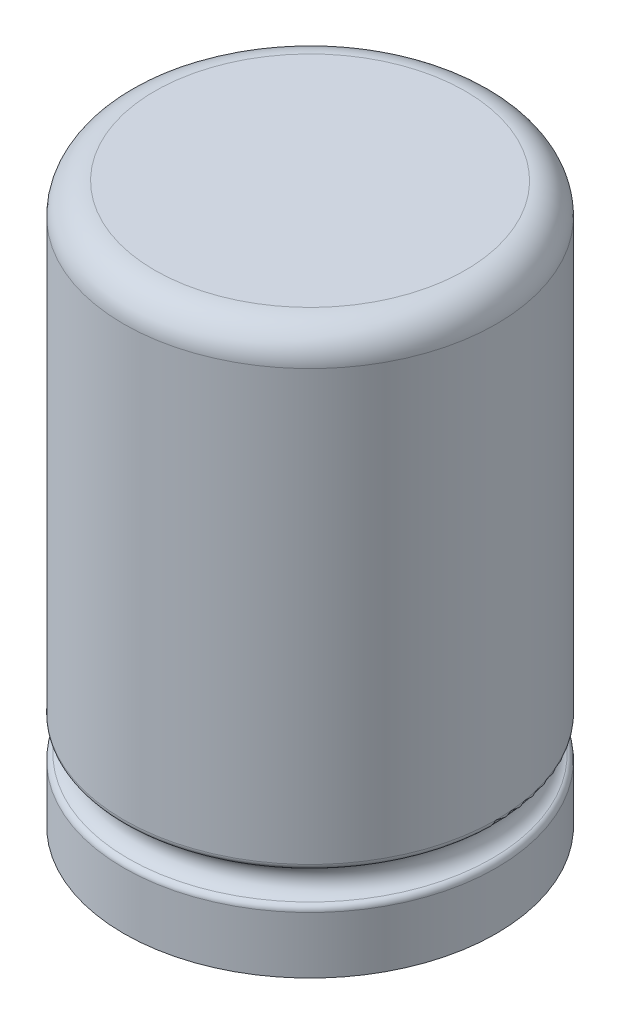
from build123d import *

# Parameters (mm, degrees)
FILLET1_R = 0.1


with BuildPart() as part:
    # Sketch1 → Revolve1 (revolve)
    with BuildSketch(Plane.XY, mode=Mode.PRIVATE) as revolve1_sk:
        with BuildLine():
            Line((0, 0), (3, 0))
            Line((3, 0), (3, 1))
            ThreePointArc((3, 1), (2.75, 1.25), (3, 1.5))
            Line((3, 1.5), (3, 8.5))
            ThreePointArc((3, 8.5), (2.853553391, 8.853553391), (2.5, 9))
            Line((2.5, 9), (0, 9))
            Line((0, 9), (0, 0))
        make_face()
    revolve(revolve1_sk.sketch.rotate(Axis((0, -5.130376558, 0), (0, 1, 0)), 90), axis=Axis((0, -5.130376558, 0), (0, 1, 0)))

    # Fillet1
    fillet1_edges = [part.edges().sort_by_distance(p)[0] for p in [
        (0, 1.5, 3),
        (0, 1, 3),
    ]]
    fillet(fillet1_edges, radius=FILLET1_R)


solid = part.part
